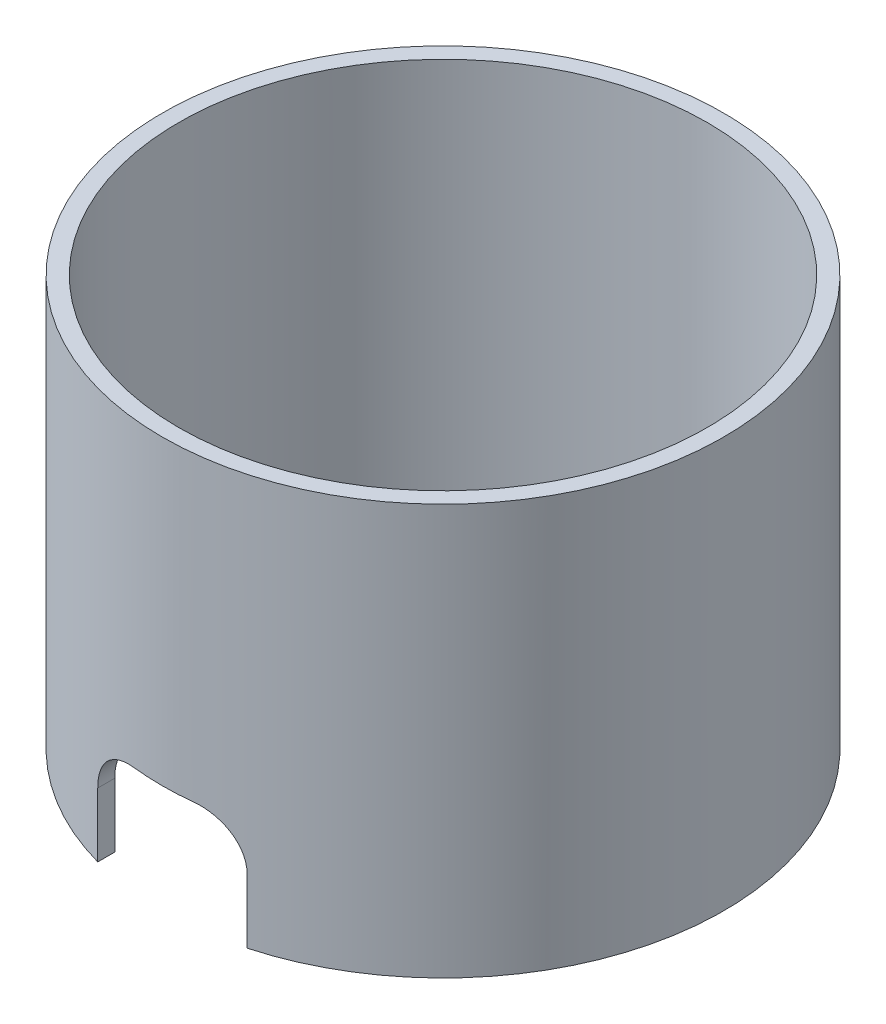
from build123d import *

# Parameters (mm, degrees)
SKETCH1_R           = 855
SKETCH1_R_2         = 805
BOSS_EXTRUDE1_DEPTH = 1300
CUT_EXTRUDE1_DEPTH  = 2646
CUT_EXTRUDE2_START  = -50
SKETCH3_R           = 855
CUT_EXTRUDE2_DEPTH  = 50
SHELL1_T            = -3


with BuildPart() as part:
    # Sketch1 → Boss-Extrude1 (new body)
    with BuildSketch(Plane(origin=(0, 0, 0), x_dir=(1, 0, 0), z_dir=(0, 1, 0))):
        with Locations(Location((0, 0, 0), (0, 0, 270))):
            Circle(SKETCH1_R)
        with Locations(Location((0, 0, 0), (0, 0, 270))):
            Circle(SKETCH1_R_2, mode=Mode.SUBTRACT)
    extrude(amount=BOSS_EXTRUDE1_DEPTH)

    # Sketch2 → Cut-Extrude1 (cut)
    with BuildSketch(Plane.XY):
        with BuildLine():
            Line((92.561405604, 330), (-92.561405604, 330))
            ThreePointArc((-92.561405604, 330), (-188.020821064, 290.45941546), (-227.561405604, 195))
            Line((-227.561405604, 195), (-227.561405604, -45))
            ThreePointArc((-227.561405604, -45), (-188.020821064, -140.45941546), (-92.561405604, -180))
            Line((-92.561405604, -180), (92.561405604, -180))
            ThreePointArc((92.561405604, -180), (188.020821064, -140.45941546), (227.561405604, -45))
            Line((227.561405604, -45), (227.561405604, 195))
            ThreePointArc((227.561405604, 195), (188.020821064, 290.45941546), (92.561405604, 330))
        make_face()
    extrude(amount=CUT_EXTRUDE1_DEPTH, mode=Mode.SUBTRACT)

    # Sketch3 → Cut-Extrude2 (cut)
    with BuildSketch(Plane(origin=(0, 1300, 0), x_dir=(1, 0, 0), z_dir=(0, 1, 0)).offset(CUT_EXTRUDE2_START)):
        with Locations(Location((0, 0, 0), (0, 0, 254.56448344))):
            Circle(SKETCH3_R)
    extrude(amount=CUT_EXTRUDE2_DEPTH, mode=Mode.SUBTRACT)

    # Shell1
    shell1_openings = [part.faces().sort_by_distance(p)[0] for p in [
        (251.527382632, 0, 798.163487829),
    ]]
    offset(amount=SHELL1_T, openings=shell1_openings)


solid = part.part
